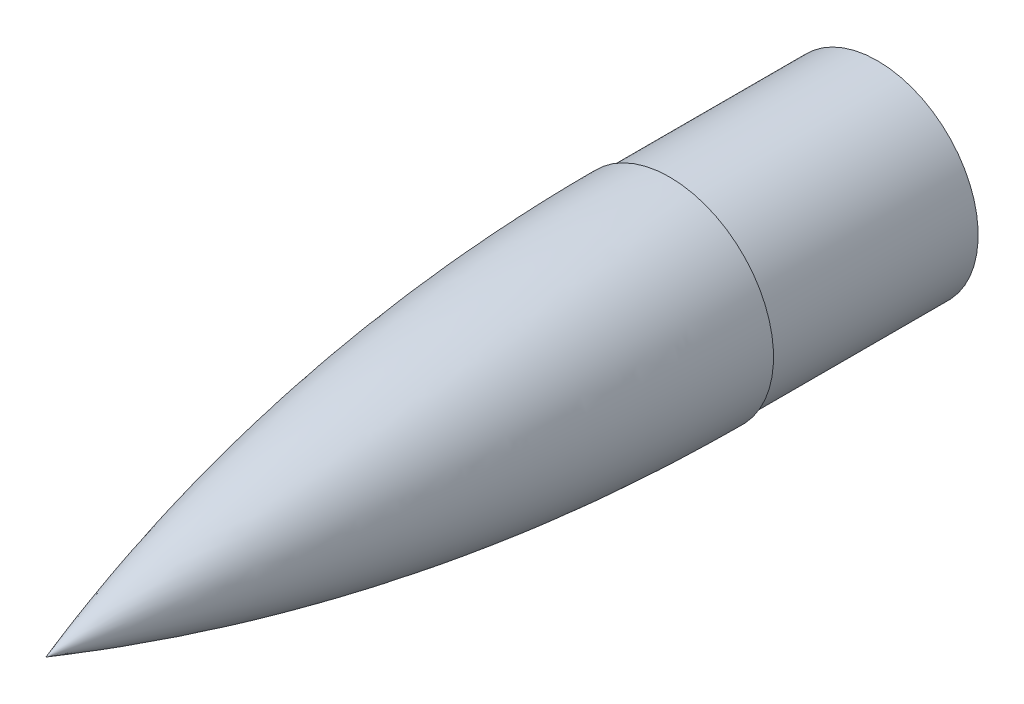
from build123d import *

# Parameters (mm, degrees)
SKETCH2_R           = 49.2125
BOSS_EXTRUDE1_DEPTH = 50.8
SKETCH3_R           = 9.525
SKETCH4_R           = 49.2125
SKETCH4_R_2         = 9.525
BOSS_EXTRUDE2_DEPTH = 50.8


with BuildPart() as part:
    # Sketch1 → Revolve1 (revolve)
    with BuildSketch(Plane(origin=(0, 0, 0), x_dir=(0, 0, -1), z_dir=(1, 0, 0))):
        with BuildLine():
            Line((0, 0), (-304.8, 0))
            add(Edge.make_bspline(
                [(-304.8, 0), (-304.382425601, 0.143168366), (-303.540765888, 0.430899345), (-301.740901659, 1.044224359), (-299.788343499, 1.703616117), (-297.798910734, 2.370622283), (-295.782175929, 3.041960911), (-293.777683441, 3.704074038), (-291.768115862, 4.362899187), (-289.746498304, 5.020634276), (-287.712339913, 5.677355174), (-268.688556224, 11.771202945), (-231.321588698, 22.614032917), (-177.061866436, 35.203944952), (-118.24504839, 44.082248155), (-74.116427434, 48.134305599), (-47.14784979, 49.654737541), (-36.353282187, 50.114030962), (-28.794561554, 50.366026549), (-23.934493272, 50.49822726), (-20.694154368, 50.573944325), (-17.741054824, 50.63389122), (-15.603916609, 50.671594447), (-13.478042738, 50.704275318), (-11.363951605, 50.732021274), (-9.516855824, 50.752830907), (-7.391927552, 50.771857001), (-5.292027124, 50.786126656), (-3.234867855, 50.7956398), (-1.330315082, 50.799207238), (-0.441435733, 50.800000002), (0, 50.800000002)],
                knots=[0.082835744, 0.082835744, 0.082835744, 0.082835744, 0.082835744, 0.088524103, 0.094212462, 0.099900821, 0.10558918, 0.111277539, 0.116965898, 0.122654257, 0.128342616, 0.134156146, 0.139969677, 0.337629697, 0.546916774, 0.732949735, 0.779457974, 0.814339154, 0.837593273, 0.849220333, 0.860847393, 0.866660923, 0.872474453, 0.88100699, 0.88385117, 0.889539528, 0.895227886, 0.900916244, 0.906604603, 0.912292961, 0.917981319, 0.917981319, 0.917981319, 0.917981319, 0.917981319], degree=4))
            Line((0, 50.800000002), (0, 0))
        make_face()
    revolve(axis=Axis((0, 0, 0), (0, 0, 1)))

    # Sketch2 → Boss-Extrude1 (add)
    with BuildSketch(Plane(origin=(0, 0, 0), x_dir=(-1, 0, 0), z_dir=(0, 0, -1))):
        with Locations(Location((0, 0, 0), (0, 0, 90))):
            Circle(SKETCH2_R)
    extrude(amount=BOSS_EXTRUDE1_DEPTH)

    # Sketch3 → Cut-Revolve3 (revolve, cut)
    with BuildSketch(Plane(origin=(0, 0, -50.8), x_dir=(-1, 0, 0), z_dir=(0, 0, -1)), mode=Mode.PRIVATE) as cut_revolve3_sk:
        with Locations((-25.4, 0)):
            Circle(SKETCH3_R)
    revolve(cut_revolve3_sk.sketch.rotate(Axis((0, 0, -50.8), (0, 1, 0)), 270), axis=Axis((0, 0, -50.8), (0, 1, 0)), mode=Mode.SUBTRACT)

    # Sketch4 → Boss-Extrude2 (add)
    with BuildSketch(Plane(origin=(0, 0, -50.8), x_dir=(-1, 0, 0), z_dir=(0, 0, -1))):
        with Locations(Location((0, 0, 0), (0, 0, 90))):
            Circle(SKETCH4_R)
        with Locations(Location((-25.4, 0, 0), (0, 0, 180))):
            Circle(SKETCH4_R_2, mode=Mode.SUBTRACT)
        with Locations(Location((25.4, 0, 0), (0, 0, 270))):
            Circle(SKETCH4_R_2, mode=Mode.SUBTRACT)
    extrude(amount=BOSS_EXTRUDE2_DEPTH)


solid = part.part
